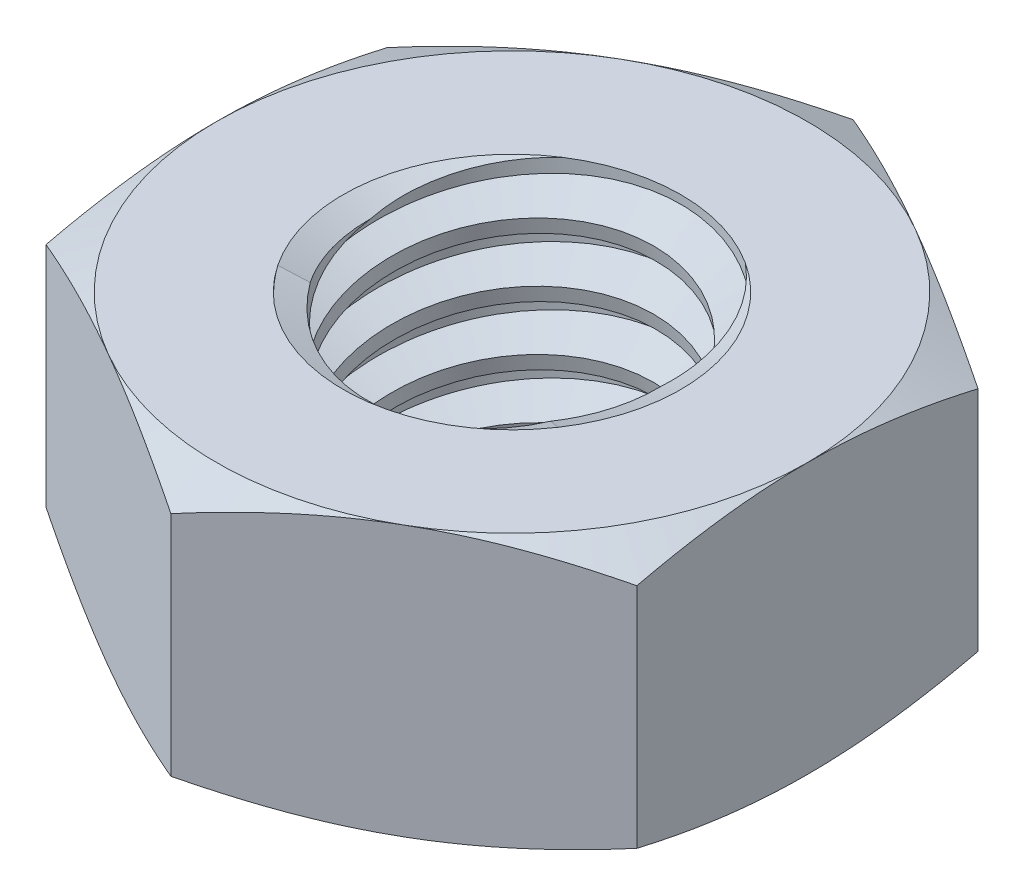
from build123d import *

# Parameters (mm, degrees)
EXTRUDE1_DEPTH      = 1.6
SKETCH2_W           = 2
SKETCH2_H           = 3.2
LPATTERN1_COUNT     = 5
LPATTERN1_PITCH     = 0.7
LPATTERN1_COL_COUNT = 2
LPATTERN1_COL_PITCH = 0.7


with BuildPart() as part:
    # Sketch1 → Extrude1 (new, symmetric)
    with BuildSketch(Plane(origin=(0, 0, 0), x_dir=(1, 0, 0), z_dir=(0, 1, 0))):
        Polygon((0, 4.041451884), (-3.5, 2.020725942), (-3.5, -2.020725942), (0, -4.041451884), (3.5, -2.020725942), (3.5, 2.020725942), align=None)
    extrude(amount=EXTRUDE1_DEPTH, both=True)

    # Sketch4 → Cut-Revolve2 (revolve, cut)
    with BuildSketch(Plane(origin=(0, 0, 0), x_dir=(0, 0, -1), z_dir=(1, 0, 0))):
        Polygon((0, 1.6), (2, 1.6), (1.679577111, 1.450584353), (1.679577111, -1.450584353), (2, -1.6), (0, -1.6), align=None)
    revolve(axis=Axis((0, 1.6, 0), (0, 1, 0)), mode=Mode.SUBTRACT)


with BuildPart() as body_2:
    # Sketch2 → Revolve1 (revolve)
    with BuildSketch(Plane(origin=(0, 0, 0), x_dir=(0, 0, -1), z_dir=(1, 0, 0))):
        with Locations((1, 0)):
            Rectangle(SKETCH2_W, SKETCH2_H)
    revolve(axis=Axis((0, -3.6, 0), (0, 1, 0)))

    # Sketch3 → Cut-Revolve1 (revolve, cut)
    with BuildSketch(Plane(origin=(0, 0, 0), x_dir=(0, 0, -1), z_dir=(1, 0, 0)), mode=Mode.PRIVATE) as cut_revolve1_sk:
        Polygon((2.015083279, 1.513809834), (2.120666232, 0.910478673), (1.709743669, 1.060641574), (1.679577111, 1.233021905), align=None)
    cut_revolve1 = revolve(cut_revolve1_sk.sketch.rotate(Axis((0, 1.6, 0.13120342), (0, -0.9850304671557042, -0.17238033175224854)), 180), axis=Axis((0, 1.6, 0.13120342), (0, -0.9850304671557042, -0.17238033175224854)), mode=Mode.SUBTRACT)

    # LPattern1: Cut-Revolve1 ×5
    with Locations(*[(0, -i * LPATTERN1_PITCH, 0) for i in range(1, LPATTERN1_COUNT)]):
        add(cut_revolve1, mode=Mode.SUBTRACT)

    # LPattern1 col: Cut-Revolve1 ×2
    with Locations(*[(0, i * LPATTERN1_COL_PITCH, 0) for i in range(1, LPATTERN1_COL_COUNT)]):
        add(cut_revolve1, mode=Mode.SUBTRACT)


with BuildPart() as part_1:
    add(part.part)

    # Combine1: cut body 2
    add(body_2.part, mode=Mode.SUBTRACT)

    # Sketch5 → Cut-Revolve3 (revolve, cut)
    with BuildSketch(Plane(origin=(0, 0, 0), x_dir=(0, 0, -1), z_dir=(1, 0, 0)), mode=Mode.PRIVATE) as cut_revolve3_sk:
        Polygon((0, -1.6), (3.5, -1.6), (4.041451884, -1.34751684), (4.041451884, 1.34751684), (3.5, 1.6), (0, 1.6), (0, 2.87), (5.311451884, 2.87), (5.311451884, -2.87), (0, -2.87), align=None)
    revolve(cut_revolve3_sk.sketch.rotate(Axis((0, -1.6, 0), (0, 1, 0)), 54.612382926), axis=Axis((0, -1.6, 0), (0, 1, 0)), mode=Mode.SUBTRACT)


solid = part_1.part
